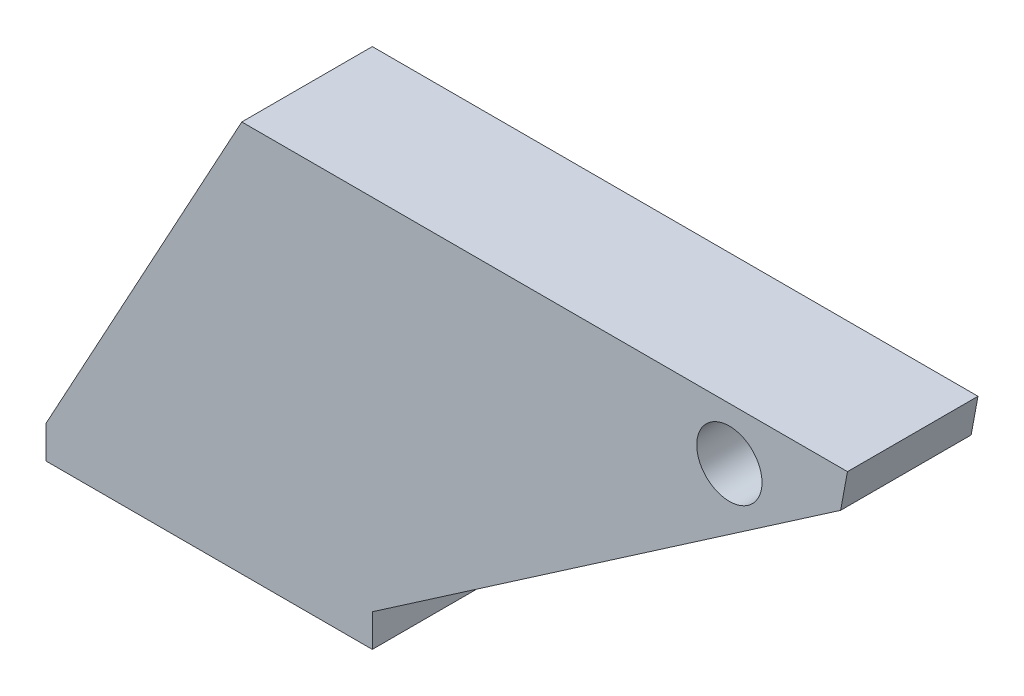
from build123d import *

# Parameters (mm, degrees)
SKETCH_1_R          = 5
EXTRUDE_1_DEPTH     = 20
CHAMFER_1_SIZE      = 10
CHAMFER_1_SIZE2     = 7.191291792
SKETCH_2_R          = 5
CUT_EXTRUDE_1_DEPTH = 10


with BuildPart() as part:
    # 草图1 → 凸台-拉伸1 (new body)
    with BuildSketch(Plane.XY):
        Polygon((-58.954112629, -2.007906554), (-58.954112629, -7.007906554), (-8.954112629, -7.007906554), (-8.954112629, -2.007906554), (71.045887371, 52.992093446), (-28.954112629, 52.992093446), align=None)
        with Locations((45.756585656, 44.992093446)):
            Circle(SKETCH_1_R, mode=Mode.SUBTRACT)
    extrude(amount=EXTRUDE_1_DEPTH)

    # 倒角1
    chamfer_1_edges = [part.edges().sort_by_distance(p)[0] for p in [
        (71.045887371, 52.992093446, 10),
    ]]
    chamfer_1_side = [part.faces().sort_by_distance(p)[0] for p in [
        (31.045887371, 25.492093446, 10),
    ]]
    chamfer(chamfer_1_edges, length=CHAMFER_1_SIZE, length2=CHAMFER_1_SIZE2, reference=chamfer_1_side[0])

    # 草图2 → 切除-拉伸1 (cut)
    with BuildSketch(Plane.XZ.offset(7.007906554)):
        with Locations((-23.954112629, 10)):
            Circle(SKETCH_2_R)
    extrude(amount=-CUT_EXTRUDE_1_DEPTH, mode=Mode.SUBTRACT)


solid = part.part
